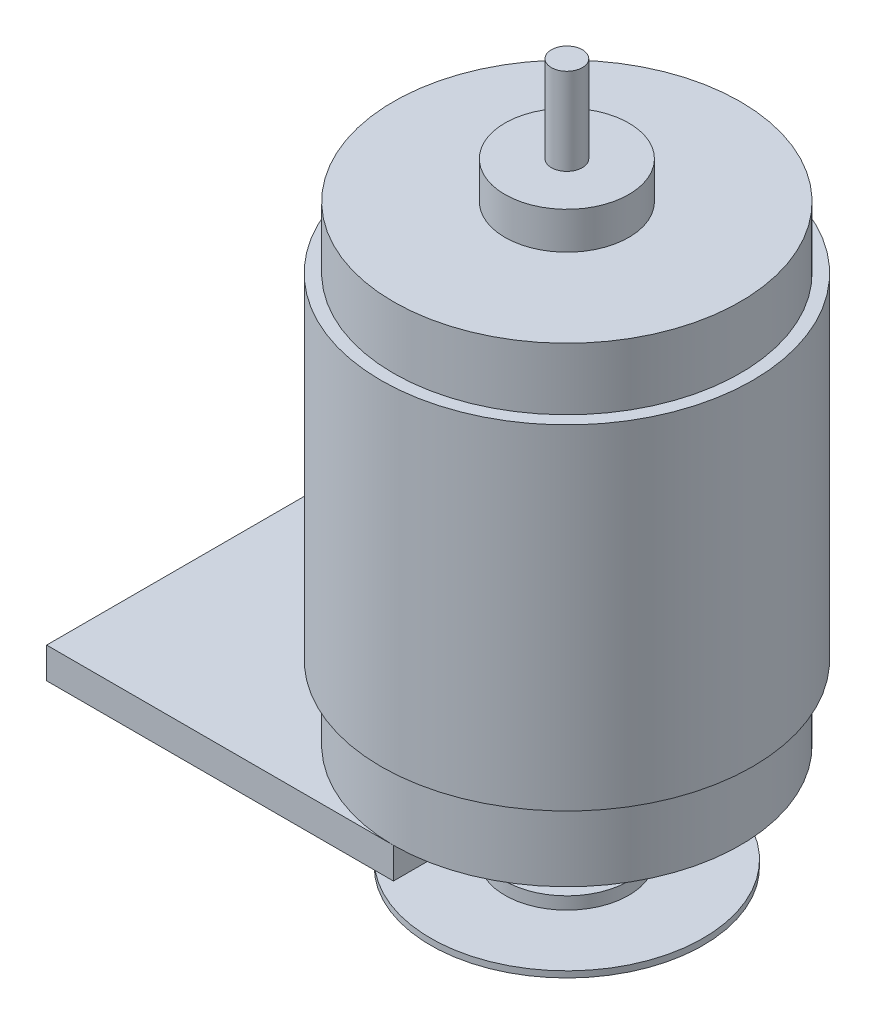
from build123d import *

# Parameters (mm, degrees)
SKETCH1_R            = 15
BOSS_EXTRUDE1_DEPTH  = 27
SKETCH2_R            = 14
BOSS_EXTRUDE2_DEPTH  = 5
SKETCH3_R            = 5
BOSS_EXTRUDE3_DEPTH  = 3
SKETCH4_R            = 1.25
BOSS_EXTRUDE4_DEPTH  = 7
BOSS_EXTRUDE5_START  = 6
SKETCH5_R            = 14
BOSS_EXTRUDE5_DEPTH  = 6
BOSS_EXTRUDE6_START  = 3
SKETCH6_R            = 5
BOSS_EXTRUDE6_DEPTH  = 3
SKETCH7_W            = 28
SKETCH7_H            = 28
BOSS_EXTRUDE7_DEPTH  = 2.5
BOSS_EXTRUDE8_START  = 4
SKETCH8_R            = 1.25
BOSS_EXTRUDE8_DEPTH  = 4
BOSS_EXTRUDE9_START  = 1
SKETCH9_R            = 5
BOSS_EXTRUDE9_DEPTH  = 1
SKETCH10_R           = 11
BOSS_EXTRUDE10_DEPTH = 0.5
BOSS_EXTRUDE11_START = 1
SKETCH11_R           = 5
BOSS_EXTRUDE11_DEPTH = 1
BOSS_EXTRUDE12_START = 3
SKETCH12_R           = 1.25
BOSS_EXTRUDE12_DEPTH = 3


with BuildPart() as part:
    # Sketch1 → Boss-Extrude1 (new body)
    with BuildSketch(Plane(origin=(0, 0, 0), x_dir=(1, 0, 0), z_dir=(0, 1, 0))):
        with Locations(Location((0, 0, 0), (0, 0, 270))):
            Circle(SKETCH1_R)
    extrude(amount=BOSS_EXTRUDE1_DEPTH)

    # Sketch2 → Boss-Extrude2 (add)
    with BuildSketch(Plane(origin=(0, 27, 0), x_dir=(1, 0, 0), z_dir=(0, 1, 0))):
        with Locations(Location((0, 0, 0), (0, 0, 270))):
            Circle(SKETCH2_R)
    extrude(amount=BOSS_EXTRUDE2_DEPTH)

    # Sketch3 → Boss-Extrude3 (add)
    with BuildSketch(Plane(origin=(0, 32, 0), x_dir=(1, 0, 0), z_dir=(0, 1, 0))):
        with Locations(Location((0, 0, 0), (0, 0, 270))):
            Circle(SKETCH3_R)
    extrude(amount=BOSS_EXTRUDE3_DEPTH)

    # Sketch4 → Boss-Extrude4 (add)
    with BuildSketch(Plane(origin=(0, 35, 0), x_dir=(1, 0, 0), z_dir=(0, 1, 0))):
        with Locations(Location((0, 0, 0), (0, 0, 270))):
            Circle(SKETCH4_R)
    extrude(amount=BOSS_EXTRUDE4_DEPTH)

    # Sketch5 → Boss-Extrude5 (add)
    with BuildSketch(Plane.XZ.offset(BOSS_EXTRUDE5_START)):
        with Locations(Location((0, 0, 0), (0, 0, 90))):
            Circle(SKETCH5_R)
    extrude(amount=-BOSS_EXTRUDE5_DEPTH)

    # Sketch6 → Boss-Extrude6 (add)
    with BuildSketch(Plane.XZ.offset(6).offset(BOSS_EXTRUDE6_START)):
        with Locations(Location((0, 0, 0), (0, 0, 90))):
            Circle(SKETCH6_R)
    extrude(amount=-BOSS_EXTRUDE6_DEPTH)

    # Sketch7 → Boss-Extrude7 (add)
    with BuildSketch(Plane.XZ.offset(6)):
        with Locations((-14, 0)):
            Rectangle(SKETCH7_W, SKETCH7_H)
    extrude(amount=BOSS_EXTRUDE7_DEPTH)

    # Sketch8 → Boss-Extrude8 (add)
    with BuildSketch(Plane.XZ.offset(9).offset(BOSS_EXTRUDE8_START)):
        with Locations(Location((0, 0, 0), (0, 0, 90))):
            Circle(SKETCH8_R)
    extrude(amount=-BOSS_EXTRUDE8_DEPTH)

    # Sketch9 → Boss-Extrude9 (add)
    with BuildSketch(Plane.XZ.offset(13).offset(BOSS_EXTRUDE9_START)):
        with Locations(Location((0, 0, 0), (0, 0, 270))):
            Circle(SKETCH9_R)
    extrude(amount=-BOSS_EXTRUDE9_DEPTH)

    # Sketch10 → Boss-Extrude10 (add)
    with BuildSketch(Plane.XZ.offset(14)):
        with Locations(Location((0, 0, 0), (0, 0, 270))):
            Circle(SKETCH10_R)
    extrude(amount=BOSS_EXTRUDE10_DEPTH)

    # Sketch11 → Boss-Extrude11 (add)
    with BuildSketch(Plane.XZ.offset(14.5).offset(BOSS_EXTRUDE11_START)):
        with Locations(Location((0, 0, 0), (0, 0, 270))):
            Circle(SKETCH11_R)
    extrude(amount=-BOSS_EXTRUDE11_DEPTH)

    # Sketch12 → Boss-Extrude12 (add)
    with BuildSketch(Plane.XZ.offset(15.5).offset(BOSS_EXTRUDE12_START)):
        with Locations(Location((0, 0, 0), (0, 0, 90))):
            Circle(SKETCH12_R)
    extrude(amount=-BOSS_EXTRUDE12_DEPTH)


solid = part.part
